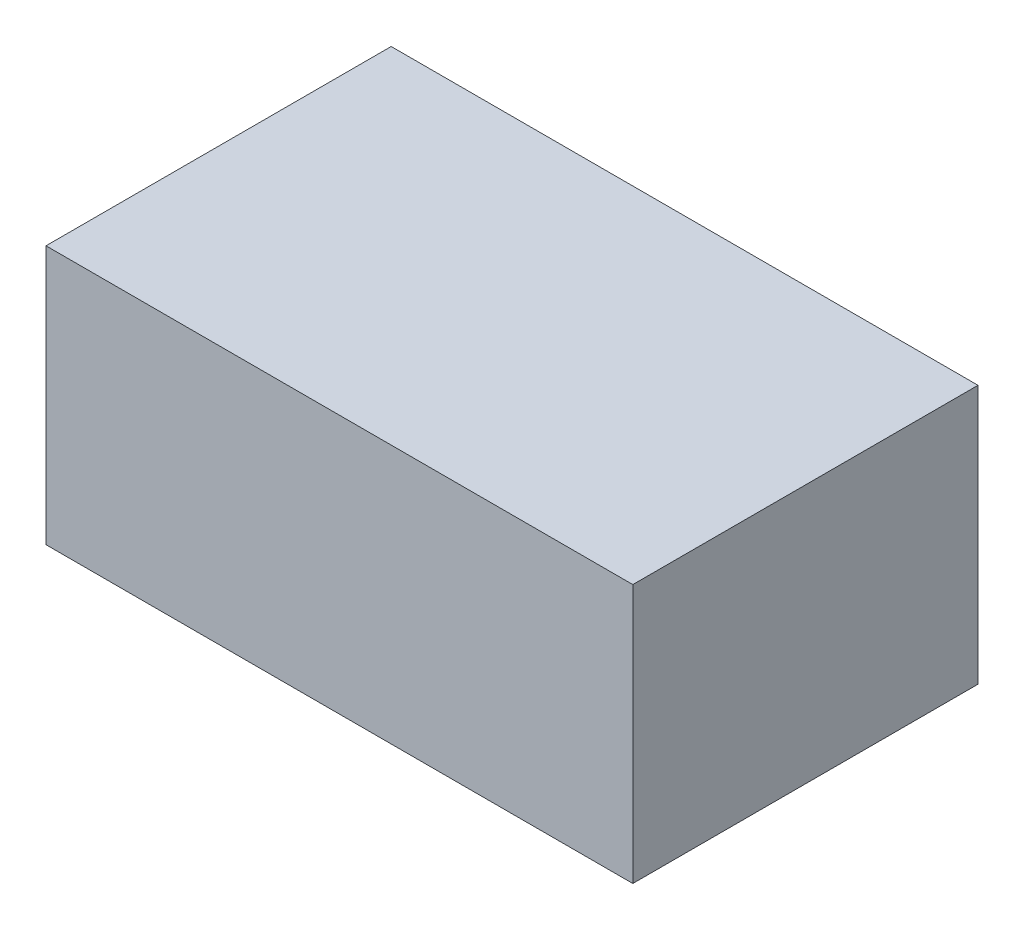
from build123d import *

# Parameters (mm, degrees)
SKETCH_1_W      = 68
SKETCH_1_H      = 30
EXTRUDE_1_DEPTH = 40


with BuildPart() as part:
    # 草图1 → 凸台-拉伸1 (new body)
    with BuildSketch(Plane.XY):
        Rectangle(SKETCH_1_W, SKETCH_1_H)
    extrude(amount=EXTRUDE_1_DEPTH)


solid = part.part
